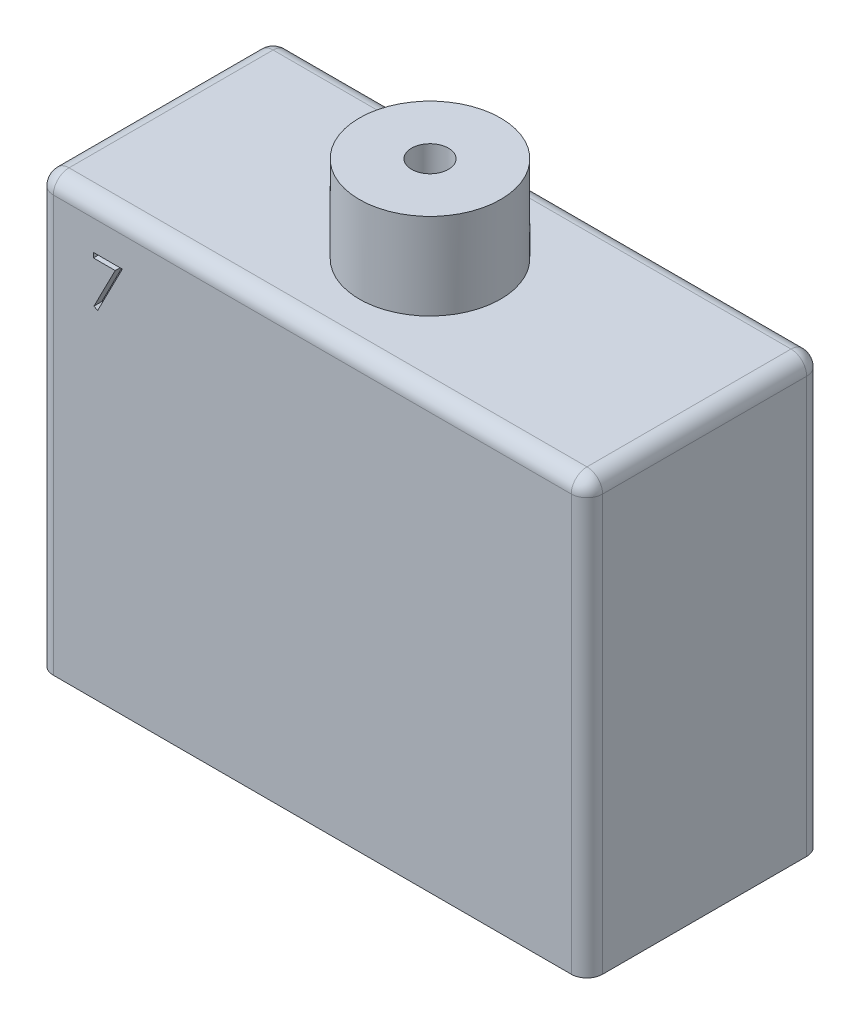
from build123d import *

# Parameters (mm, degrees)
CROQUIS1_W              = 70
CROQUIS1_H              = 30
SALIENTE_EXTRUIR1_DEPTH = 55
CROQUIS9_R              = 4.15
CORTAR_EXTRUIR6_DEPTH   = 27
REDONDEO1_R             = 2
CORTAR_EXTRUIR9_DEPTH   = 1
CROQUIS13_R             = 9
SALIENTE_EXTRUIR2_DEPTH = 11
CROQUIS14_R             = 2.35
CORTAR_EXTRUIR10_DEPTH  = 44


with BuildPart() as part:
    # Croquis1 → Saliente-Extruir1 (new body)
    with BuildSketch(Plane(origin=(0, 0, 0), x_dir=(1, 0, 0), z_dir=(0, 1, 0))):
        Rectangle(CROQUIS1_W, CROQUIS1_H)
    extrude(amount=SALIENTE_EXTRUIR1_DEPTH)

    # Croquis9 → Cortar-Extruir6 (cut)
    with BuildSketch(Plane(origin=(0, 0, -15), x_dir=(-1, 0, 0), z_dir=(0, 0, -1))):
        with Locations((-27.5, 32)):
            Circle(CROQUIS9_R)
        with Locations((27.5, 32)):
            Circle(CROQUIS9_R)
    extrude(amount=-CORTAR_EXTRUIR6_DEPTH, mode=Mode.SUBTRACT)

    # Redondeo1
    redondeo1_edges = [part.edges().sort_by_distance(p)[0] for p in [
        (-35, 55, 0),
        (0, 55, 15),
        (35, 55, 0),
        (0, 55, -15),
        (35, 27.5, 15),
        (-35, 27.5, 15),
        (-35, 27.5, -15),
        (35, 27.5, -15),
    ]]
    fillet(redondeo1_edges, radius=REDONDEO1_R)

    # Croquis12 → Cortar-Extruir9 (cut)
    with BuildSketch(Plane.XY.offset(15)):
        Polygon((-27.897004406, 49.221392525), (-24.204696713, 49.221392525), (-27.358542867, 43.067546371), (-27.823687098, 43.323555986), (-25.115754406, 48.606007909), (-27.897004406, 48.606007909), align=None)
    extrude(amount=-CORTAR_EXTRUIR9_DEPTH, mode=Mode.SUBTRACT)

    # Croquis13 → Saliente-Extruir2 (add)
    with BuildSketch(Plane(origin=(0, 55, 0), x_dir=(1, 0, 0), z_dir=(0, 1, 0))):
        with Locations(Location((0, 0, 0), (0, 0, 90))):
            Circle(CROQUIS13_R)
    extrude(amount=SALIENTE_EXTRUIR2_DEPTH)

    # Croquis14 → Cortar-Extruir10 (cut)
    with BuildSketch(Plane(origin=(0, 66, 0), x_dir=(1, 0, 0), z_dir=(0, 1, 0))):
        with Locations(Location((0, 0, 0), (0, 0, 270))):
            Circle(CROQUIS14_R)
    extrude(amount=-CORTAR_EXTRUIR10_DEPTH, mode=Mode.SUBTRACT)


solid = part.part
